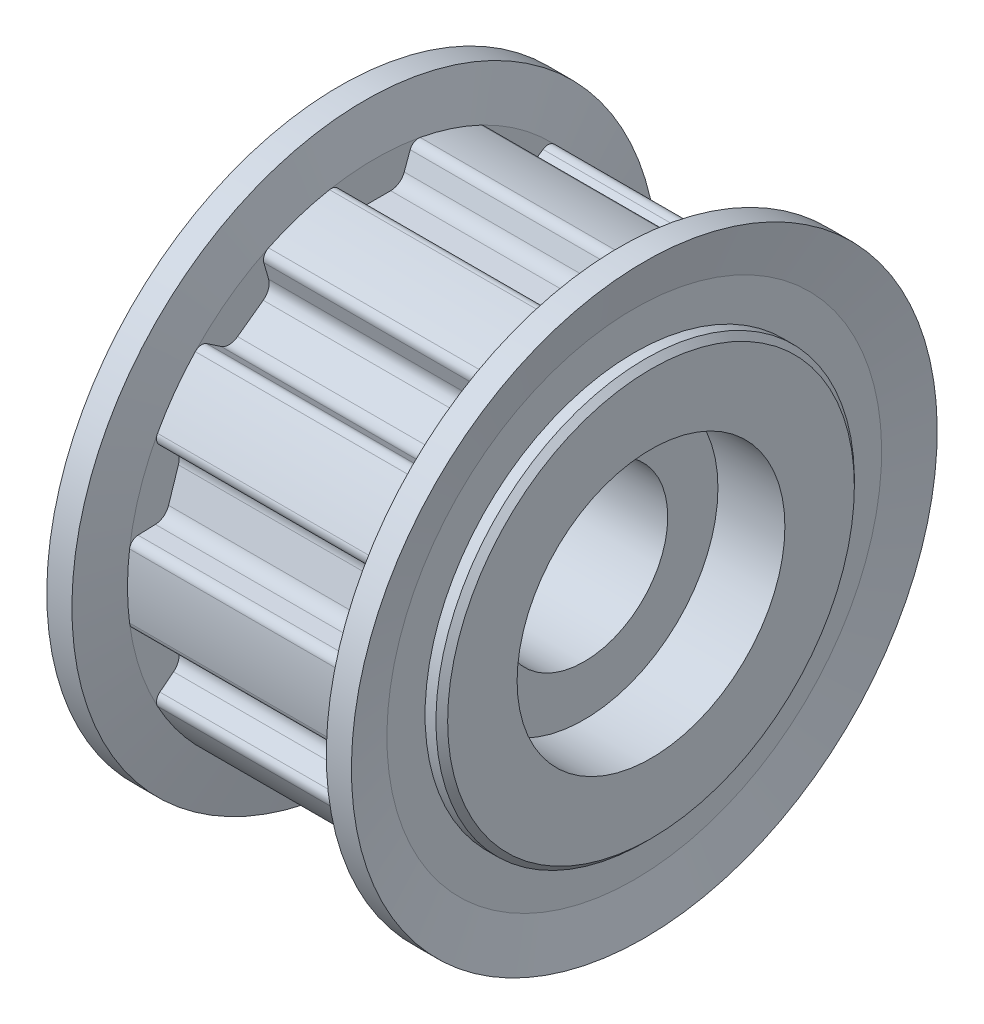
from build123d import *

# Parameters (mm, degrees)
CUT_EXTRUDE_START        = 16.5
CUT_EXTRUDE_1_DEPTH      = 14
PATTERN_CIRCULAR_1_COUNT = 10
SKETCH_6_R               = 5
CUT_EXTRUDE_2_DEPTH      = 32.200961524
CHAMFER_1_SIZE           = 0.18
SKETCH_10_W              = 4
SKETCH_10_H              = 8


with BuildPart() as part:
    # 草图3 → 旋转1 (revolve)
    with BuildSketch(Plane.XY):
        Polygon((0, 0), (0, 12.15), (0.35, 12.5), (2.5, 12.5), (2.5, 14.78), (16.5, 14.78), (16.5, 12.5), (18.65, 12.5), (19, 12.15), (19, 0), align=None)
    revolve(axis=Axis((19, 0, 0), (-1, 0, 0)))

    # 草图4 → Cut-Extrude 1 (cut)
    with BuildSketch(Plane(origin=(0, 0, 0), x_dir=(0, 0, -1), z_dir=(1, 0, 0)).offset(CUT_EXTRUDE_START)):
        with BuildLine():
            Line((-0.947821517, 12.65), (0.947821517, 12.65))
            ThreePointArc((0.947821517, 12.65), (1.441097252, 12.805529242), (1.755957171, 13.215862677))
            Line((1.755957171, 13.215862677), (2.110677954, 14.190450018))
            ThreePointArc((2.110677954, 14.190450018), (2.345915061, 14.469435976), (2.705740936, 14.530222503))
            ThreePointArc((2.705740936, 14.530222503), (0, 14.78), (-2.705740936, 14.530222503))
            ThreePointArc((-2.705740936, 14.530222503), (-2.345915061, 14.469435976), (-2.110677954, 14.190450018))
            Line((-2.110677954, 14.190450018), (-1.755957171, 13.215862677))
            ThreePointArc((-1.755957171, 13.215862677), (-1.441097252, 12.805529242), (-0.947821517, 12.65))
        make_face()
    cut_extrude_1 = extrude(amount=-CUT_EXTRUDE_1_DEPTH, mode=Mode.SUBTRACT)

    # 阵列(圆周)1: Cut-Extrude 1 ×10 about axis
    pattern_circular_1_axis = Axis((0, 0, 0), (1, 0, 0))
    for i in range(1, PATTERN_CIRCULAR_1_COUNT):
        add(cut_extrude_1.rotate(pattern_circular_1_axis, i * 360 / PATTERN_CIRCULAR_1_COUNT), mode=Mode.SUBTRACT)

    # 草图5 → 旋转2 (revolve)
    with BuildSketch(Plane.XY, mode=Mode.PRIVATE) as revolve_2_sk:
        Polygon((1.9, 17.5), (2.5, 14.78), (2.5, 12.5), (1, 12.5), (1, 14.78), (0.4, 17.5), align=None)
        Polygon((18, 12.5), (16.5, 12.5), (16.5, 14.78), (17.1, 17.5), (18.6, 17.5), (18, 14.78), align=None)
    revolve(revolve_2_sk.sketch.rotate(Axis((0, 0, 0), (1, 0, 0)), 180), axis=Axis((0, 0, 0), (1, 0, 0)))

    # 草图6 → 切除-拉伸2 (cut, through all)
    with BuildSketch(Plane(origin=(0, 0, 0), x_dir=(0, 0, -1), z_dir=(1, 0, 0))):
        Circle(SKETCH_6_R)
    extrude(amount=CUT_EXTRUDE_2_DEPTH, mode=Mode.SUBTRACT)

    # 倒角1
    chamfer_1_edges = [part.edges().sort_by_distance(p)[0] for p in [
        (0, 0, 5),
        (19, 0, 5),
    ]]
    chamfer(chamfer_1_edges, length=CHAMFER_1_SIZE)

    # 草图10 → Cut-Revolve 8089 (revolve, cut)
    with BuildSketch(Plane.XY, mode=Mode.PRIVATE) as cut_revolve_8089_sk:
        with Locations((17, 4)):
            Rectangle(SKETCH_10_W, SKETCH_10_H)
        with Locations((2, 4)):
            Rectangle(SKETCH_10_W, SKETCH_10_H)
    revolve(cut_revolve_8089_sk.sketch.rotate(Axis((0, 0, 0), (1, 0, 0)), 90), axis=Axis((0, 0, 0), (1, 0, 0)), mode=Mode.SUBTRACT)


solid = part.part
